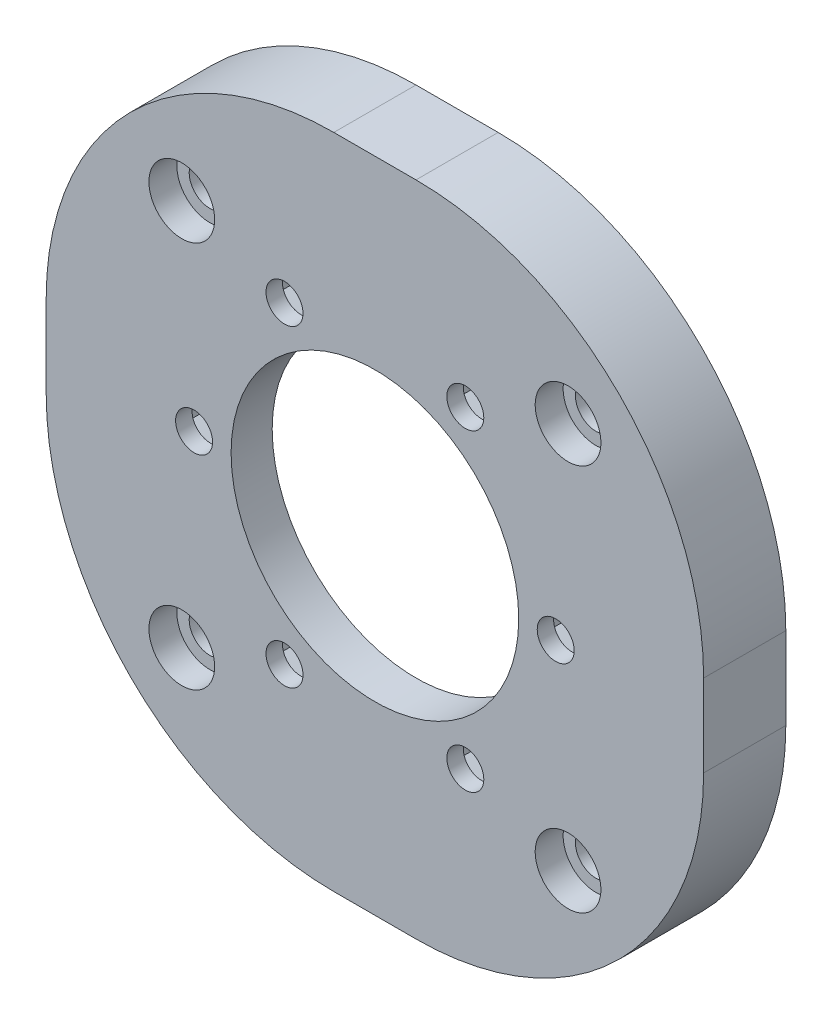
from build123d import *

# Parameters (mm, degrees)
ESQUISSE1_R             = 2.25
ESQUISSE1_R_2           = 2.5
ESQUISSE1_R_3           = 17.5
BOSS_EXTRU_1_DEPTH      = 10
ESQUISSE2_W             = 57
ESQUISSE2_H             = 57
ENL_V_MAT_EXTRU_2_DEPTH = 5
ENL_V_MAT_EXTRU_3_DEPTH = 3
ESQUISSE5_R             = 4
ENL_V_MAT_EXTRU_4_DEPTH = 3.4


with BuildPart() as part:
    # Esquisse1 → Boss.-Extru.1 (new body)
    with BuildSketch(Plane.XY):
        with BuildLine():
            Line((5, -40), (-5, -40))
            ThreePointArc((-5, -40), (-29.748737342, -29.748737342), (-40, -5))
            Line((-40, -5), (-40, 5))
            ThreePointArc((-40, 5), (-29.748737342, 29.748737342), (-5, 40))
            Line((-5, 40), (5, 40))
            ThreePointArc((5, 40), (29.748737342, 29.748737342), (40, 5))
            Line((40, 5), (40, -5))
            ThreePointArc((40, -5), (29.748737342, -29.748737342), (5, -40))
        make_face()
        with Locations((22, 0)):
            Circle(ESQUISSE1_R, mode=Mode.SUBTRACT)
        with Locations((11, -19.052558883)):
            Circle(ESQUISSE1_R, mode=Mode.SUBTRACT)
        with Locations((-11, -19.052558883)):
            Circle(ESQUISSE1_R, mode=Mode.SUBTRACT)
        with Locations((-22, 0)):
            Circle(ESQUISSE1_R, mode=Mode.SUBTRACT)
        with Locations((-11, 19.052558883)):
            Circle(ESQUISSE1_R, mode=Mode.SUBTRACT)
        with Locations((11, 19.052558883)):
            Circle(ESQUISSE1_R, mode=Mode.SUBTRACT)
        with Locations((-23.5, 23.55)):
            Circle(ESQUISSE1_R_2, mode=Mode.SUBTRACT)
        with Locations((23.5, 23.55)):
            Circle(ESQUISSE1_R_2, mode=Mode.SUBTRACT)
        with Locations((23.5, -23.55)):
            Circle(ESQUISSE1_R_2, mode=Mode.SUBTRACT)
        with Locations((-23.5, -23.55)):
            Circle(ESQUISSE1_R_2, mode=Mode.SUBTRACT)
        Circle(ESQUISSE1_R_3, mode=Mode.SUBTRACT)
    extrude(amount=BOSS_EXTRU_1_DEPTH)

    # Esquisse2 → Enlèv. mat.-Extru.2 (cut)
    with BuildSketch(Plane(origin=(0, 0, 0), x_dir=(-1, 0, 0), z_dir=(0, 0, -1))):
        Rectangle(ESQUISSE2_W, ESQUISSE2_H)
    extrude(amount=-ENL_V_MAT_EXTRU_2_DEPTH, mode=Mode.SUBTRACT)

    # Esquisse4 → Enlèv. mat.-Extru.3 (cut)
    with BuildSketch(Plane(origin=(0, 0, 5), x_dir=(-1, 0, 0), z_dir=(0, 0, -1))):
        Polygon((-7.496491289, 21.067207559), (-10.992982578, 23.094010768), (-14.496491289, 21.079362091), (-14.503508711, 17.037910207), (-11.007017422, 15.011106999), (-7.503508711, 17.025755675), align=None)
        Polygon((14.496491289, 17.025755675), (14.503508711, 21.067207559), (11.007017422, 23.094010768), (7.503508711, 21.079362091), (7.496491289, 17.037910207), (10.992982578, 15.011106999), align=None)
        Polygon((21.992982578, -4.041451884), (25.496491289, -2.026803208), (25.503508711, 2.014648676), (22.007017422, 4.041451884), (18.503508711, 2.026803208), (18.496491289, -2.014648676), align=None)
        Polygon((7.496491289, -21.067207559), (10.992982578, -23.094010768), (14.496491289, -21.079362091), (14.503508711, -17.037910207), (11.007017422, -15.011106999), (7.503508711, -17.025755675), align=None)
        Polygon((-14.496491289, -17.025755675), (-14.503508711, -21.067207559), (-11.007017422, -23.094010768), (-7.503508711, -21.079362091), (-7.496491289, -17.037910207), (-10.992982578, -15.011106999), align=None)
        Polygon((-21.992982578, 4.041451884), (-25.496491289, 2.026803208), (-25.503508711, -2.014648676), (-22.007017422, -4.041451884), (-18.503508711, -2.026803208), (-18.496491289, 2.014648676), align=None)
    extrude(amount=-ENL_V_MAT_EXTRU_3_DEPTH, mode=Mode.SUBTRACT)

    # Esquisse5 → Enlèv. mat.-Extru.4 (cut)
    with BuildSketch(Plane.XY.offset(10)):
        with Locations((-23.5, 23.55)):
            Circle(ESQUISSE5_R)
        with Locations((-23.5, -23.55)):
            Circle(ESQUISSE5_R)
        with Locations(Location((23.5, 23.55, 0), (0, 0, 180))):
            Circle(ESQUISSE5_R)
        with Locations(Location((23.5, -23.55, 0), (0, 0, 180))):
            Circle(ESQUISSE5_R)
    extrude(amount=-ENL_V_MAT_EXTRU_4_DEPTH, mode=Mode.SUBTRACT)


solid = part.part
